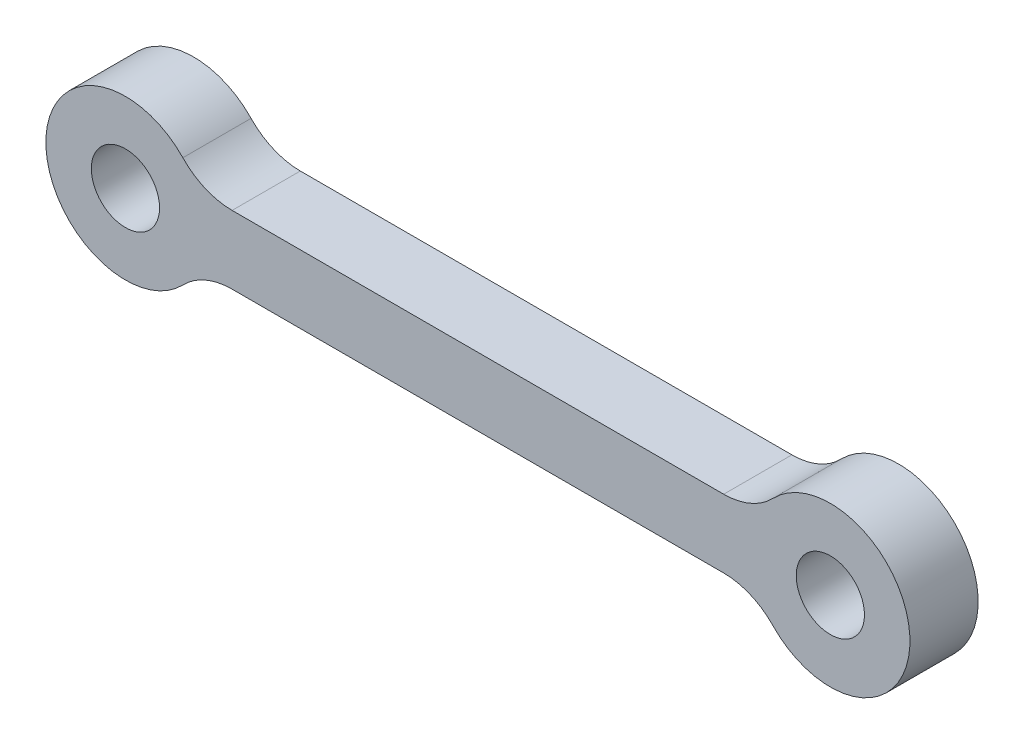
from build123d import *

# Parameters (mm, degrees)
SKETCH1_R           = 1.5
BOSS_EXTRUDE1_DEPTH = 3


with BuildPart() as part:
    # Sketch1 → Boss-Extrude1 (new body)
    with BuildSketch(Plane.XY):
        with BuildLine():
            Line((4.69041576, 1.5), (26.30958424, 1.5))
            ThreePointArc((26.30958424, 1.5), (27.486281051, 1.740401367), (28.474391514, 2.423076923))
            ThreePointArc((28.474391514, 2.423076923), (34.5, 0), (28.474391514, -2.423076923))
            ThreePointArc((28.474391514, -2.423076923), (27.486281051, -1.740401367), (26.30958424, -1.5))
            Line((26.30958424, -1.5), (4.69041576, -1.5))
            ThreePointArc((4.69041576, -1.5), (3.513718949, -1.740401367), (2.525608486, -2.423076923))
            ThreePointArc((2.525608486, -2.423076923), (-3.5, 0), (2.525608486, 2.423076923))
            ThreePointArc((2.525608486, 2.423076923), (3.513718949, 1.740401367), (4.69041576, 1.5))
        make_face()
        Circle(SKETCH1_R, mode=Mode.SUBTRACT)
        with Locations((31, 0)):
            Circle(SKETCH1_R, mode=Mode.SUBTRACT)
    extrude(amount=BOSS_EXTRUDE1_DEPTH)


solid = part.part
